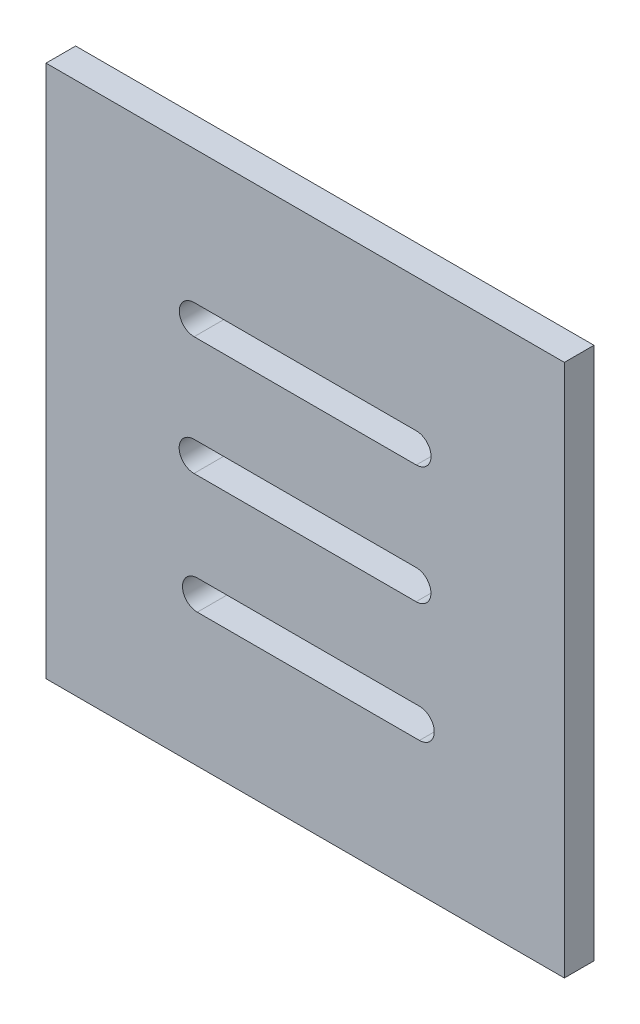
from build123d import *

# Parameters (mm, degrees)
SKETCH_1_W          = 35
SKETCH_1_H          = 36
EXTRUDE_1_DEPTH     = 2
CUT_EXTRUDE_1_REACH = 27.184


with BuildPart() as part:
    # 草图1 → 凸台-拉伸1 (new body)
    with BuildSketch(Plane.XY):
        Rectangle(SKETCH_1_W, SKETCH_1_H)
    extrude(amount=EXTRUDE_1_DEPTH)

    # 草图2 → 切除-拉伸1 (cut, up to next)
    with BuildSketch(Plane.XY.offset(2), mode=Mode.PRIVATE) as cut_extrude_1_sk1:
        with BuildLine():
            Line((-7.5, 9), (7.5, 9))
            ThreePointArc((7.5, 9), (8.5, 8), (7.5, 7))
            Line((7.5, 7), (-7.5, 7))
            ThreePointArc((-7.5, 7), (-8.5, 8), (-7.5, 9))
        make_face()
    cut_extrude_1_tool1 = extrude(cut_extrude_1_sk1.sketch, amount=-CUT_EXTRUDE_1_REACH, mode=Mode.PRIVATE) & part.part
    # 草图2 → 切除-拉伸1 (cut, up to next)
    with BuildSketch(Plane.XY.offset(2), mode=Mode.PRIVATE) as cut_extrude_1_sk2:
        with BuildLine():
            Line((-7.509739979, 1), (7.490260021, 1))
            ThreePointArc((7.490260021, 1), (8.490260021, 0), (7.490260021, -1))
            Line((7.490260021, -1), (-7.509739979, -1))
            ThreePointArc((-7.509739979, -1), (-8.509739979, 0), (-7.509739979, 1))
        make_face()
    cut_extrude_1_tool2 = extrude(cut_extrude_1_sk2.sketch, amount=-CUT_EXTRUDE_1_REACH, mode=Mode.PRIVATE) & part.part
    # 草图2 → 切除-拉伸1 (cut, up to next)
    with BuildSketch(Plane.XY.offset(2), mode=Mode.PRIVATE) as cut_extrude_1_sk3:
        with BuildLine():
            Line((-7.285332316, -7), (7.714667684, -7))
            ThreePointArc((7.714667684, -7), (8.714667684, -8), (7.714667684, -9))
            Line((7.714667684, -9), (-7.285332316, -9))
            ThreePointArc((-7.285332316, -9), (-8.285332316, -8), (-7.285332316, -7))
        make_face()
    cut_extrude_1_tool3 = extrude(cut_extrude_1_sk3.sketch, amount=-CUT_EXTRUDE_1_REACH, mode=Mode.PRIVATE) & part.part
    add(cut_extrude_1_tool1.solids().sort_by_distance((0, 8, 2))[0], mode=Mode.SUBTRACT)
    add(cut_extrude_1_tool2.solids().sort_by_distance((-0.00974, 0, 2))[0], mode=Mode.SUBTRACT)
    add(cut_extrude_1_tool3.solids().sort_by_distance((0.214668, -8, 2))[0], mode=Mode.SUBTRACT)


solid = part.part
